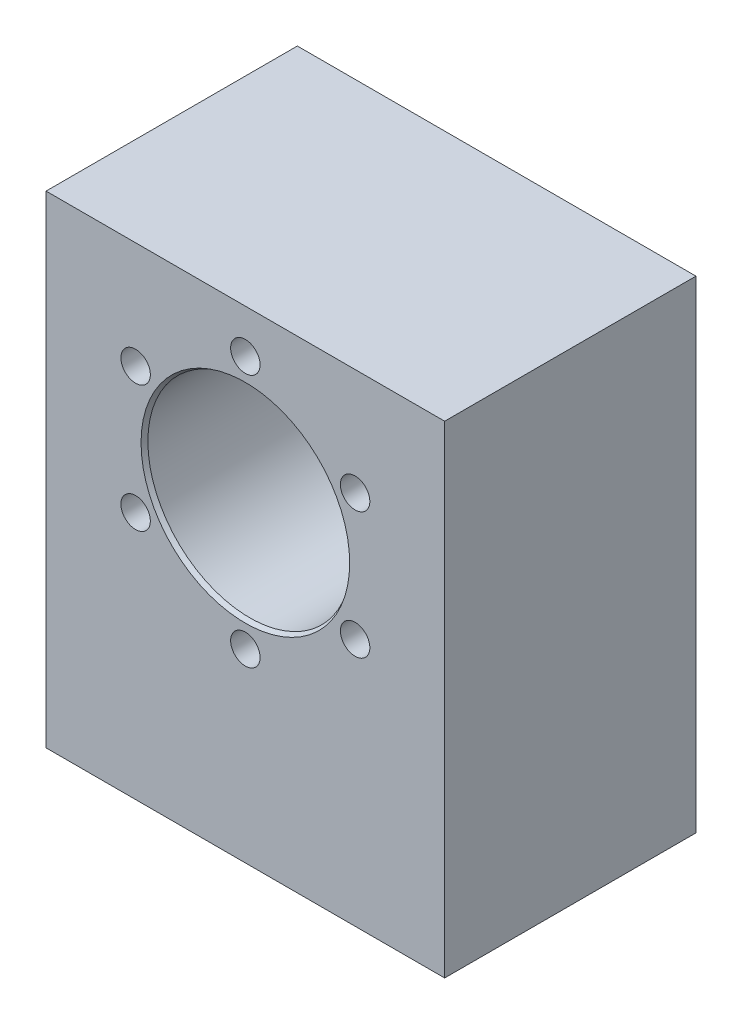
from build123d import *

# Parameters (mm, degrees)
SKETCH2_W              = 101.6
SKETCH2_H              = 114.3
BOSS_EXTRUDE1_DEPTH    = 63.5
SKETCH4_W              = 101.6
SKETCH4_H              = 5.5
CUT_EXTRUDE2_DEPTH     = 141.276084918
SKETCH6_W              = 101.6
SKETCH6_H              = 3
CUT_EXTRUDE4_DEPTH     = 108.56226104
SKETCH3_R              = 18
CUT_EXTRUDE1_DEPTH     = 106.492369392
SKETCH5_R              = 23.5
CUT_EXTRUDE3_DEPTH     = 46.24
M8_TAPPED_HOLE1_D      = 6.8
M8_TAPPED_HOLE1_DEPTH  = 26.35
M8_TAPPED_HOLE1_TIP    = 2.042926105
CHAMFER1_SIZE          = 1
CHAMFER1_SIZE2         = 0.577350269
CUT_EXTRUDE6_START     = -48.5
SKETCH9_R              = 19
CUT_EXTRUDE6_DEPTH     = 1.6
CUT_EXTRUDE7_DEPTH     = 5.08
M12_TAPPED_HOLE1_D     = 10.2
M12_TAPPED_HOLE1_DEPTH = 32.75
M12_TAPPED_HOLE1_TIP   = 3.064389157
SKETCH14_W             = 4.8
SKETCH14_H             = 111.3
CUT_EXTRUDE8_DEPTH     = 106.492369392
FILLET1_R              = 0.79375
CUT_EXTRUDE9_START     = 1.2954
SKETCH15_R             = 24.008
SKETCH15_R_2           = 23.5
CUT_EXTRUDE9_DEPTH     = 1.2954


with BuildPart() as part:
    # Sketch2 → Boss-Extrude1 (new body)
    with BuildSketch(Plane.XY):
        with Locations((0, -17.85)):
            Rectangle(SKETCH2_W, SKETCH2_H)
    extrude(amount=BOSS_EXTRUDE1_DEPTH)

    # Sketch4 → Cut-Extrude2 (cut, through all)
    with BuildSketch(Plane(origin=(0, 39.3, 0), x_dir=(1, 0, 0), z_dir=(0, 1, 0))):
        with Locations((0, -60.75)):
            Rectangle(SKETCH4_W, SKETCH4_H)
    extrude(amount=-CUT_EXTRUDE2_DEPTH, mode=Mode.SUBTRACT)

    # Sketch6 → Cut-Extrude4 (cut, through all)
    with BuildSketch(Plane.XY.offset(58)):
        with Locations((0, -73.5)):
            Rectangle(SKETCH6_W, SKETCH6_H)
    extrude(amount=-CUT_EXTRUDE4_DEPTH, mode=Mode.SUBTRACT)

    # Sketch3 → Cut-Extrude1 (cut, through all)
    with BuildSketch(Plane.XY.offset(58)):
        Circle(SKETCH3_R)
    extrude(amount=-CUT_EXTRUDE1_DEPTH, mode=Mode.SUBTRACT)

    # Sketch5 → Cut-Extrude3 (cut)
    with BuildSketch(Plane.XY.offset(58)):
        Circle(SKETCH5_R)
    extrude(amount=-CUT_EXTRUDE3_DEPTH, mode=Mode.SUBTRACT)

    # M8 Tapped Hole1
    with Locations(Plane.XY.offset(58)):
        with Locations((0, 29.25), (25.331243061, 14.625), (25.331243061, -14.625), (0, -29.25), (-25.331243061, -14.625), (-25.331243061, 14.625)):
            Hole(M8_TAPPED_HOLE1_D / 2, depth=M8_TAPPED_HOLE1_DEPTH)
            with Locations((0, 0, -(M8_TAPPED_HOLE1_DEPTH + M8_TAPPED_HOLE1_TIP / 2))):  # 118° drill point
                Cone(0, M8_TAPPED_HOLE1_D / 2, M8_TAPPED_HOLE1_TIP, mode=Mode.SUBTRACT)

    # Chamfer1
    chamfer1_edges = [part.edges().sort_by_distance(p)[0] for p in [
        (-23.5, 0, 58),
    ]]
    chamfer1_side = [part.faces().sort_by_distance(p)[0] for p in [
        (-23.5, 0, 34.88),
    ]]
    chamfer(chamfer1_edges, length=CHAMFER1_SIZE, length2=CHAMFER1_SIZE2, reference=chamfer1_side[0])

    # Sketch9 → Cut-Extrude6 (cut)
    with BuildSketch(Plane.XY.offset(58).offset(CUT_EXTRUDE6_START)):
        Circle(SKETCH9_R)
    extrude(amount=-CUT_EXTRUDE6_DEPTH, mode=Mode.SUBTRACT)

    # Sketch10 → Cut-Extrude7 (cut)
    with BuildSketch(Plane.XZ.offset(72)):
        with BuildLine():
            Line((-25.4, 36), (25.4, 36))
            ThreePointArc((25.4, 36), (31.4, 30), (25.4, 24))
            Line((25.4, 24), (-25.4, 24))
            ThreePointArc((-25.4, 24), (-31.4, 30), (-25.4, 36))
        make_face()
    extrude(amount=-CUT_EXTRUDE7_DEPTH, mode=Mode.SUBTRACT)

    # M12 Tapped Hole1
    with Locations(Plane(origin=(0, -72, 0), x_dir=(-1, 0, 0), z_dir=(0, -1, 0))):
        with Locations((31, -46), (-31, -46), (-31, -14), (31, -14)):
            Hole(M12_TAPPED_HOLE1_D / 2, depth=M12_TAPPED_HOLE1_DEPTH)
            with Locations((0, 0, -(M12_TAPPED_HOLE1_DEPTH + M12_TAPPED_HOLE1_TIP / 2))):  # 118° drill point
                Cone(0, M12_TAPPED_HOLE1_D / 2, M12_TAPPED_HOLE1_TIP, mode=Mode.SUBTRACT)

    # Sketch14 → Cut-Extrude8 (cut, through all)
    with BuildSketch(Plane(origin=(0, 0, 0), x_dir=(-1, 0, 0), z_dir=(0, 0, -1))):
        with Locations((-48.4, -16.35)):
            Rectangle(SKETCH14_W, SKETCH14_H)
        with Locations((48.4, -16.35)):
            Rectangle(SKETCH14_W, SKETCH14_H)
    extrude(amount=-CUT_EXTRUDE8_DEPTH, mode=Mode.SUBTRACT)

    # Fillet1
    fillet1_edges = [part.edges().sort_by_distance(p)[0] for p in [
        (-31.4, -66.92, 30),
        (0, -66.92, 36),
        (31.4, -66.92, 30),
        (0, -66.92, 24),
    ]]
    fillet(fillet1_edges, radius=FILLET1_R)

    # Sketch15 → Cut-Extrude9 (cut)
    with BuildSketch(Plane.XY.offset(11.76).offset(CUT_EXTRUDE9_START)):
        Circle(SKETCH15_R)
        Circle(SKETCH15_R_2, mode=Mode.SUBTRACT)
    extrude(amount=-CUT_EXTRUDE9_DEPTH, mode=Mode.SUBTRACT)


solid = part.part
